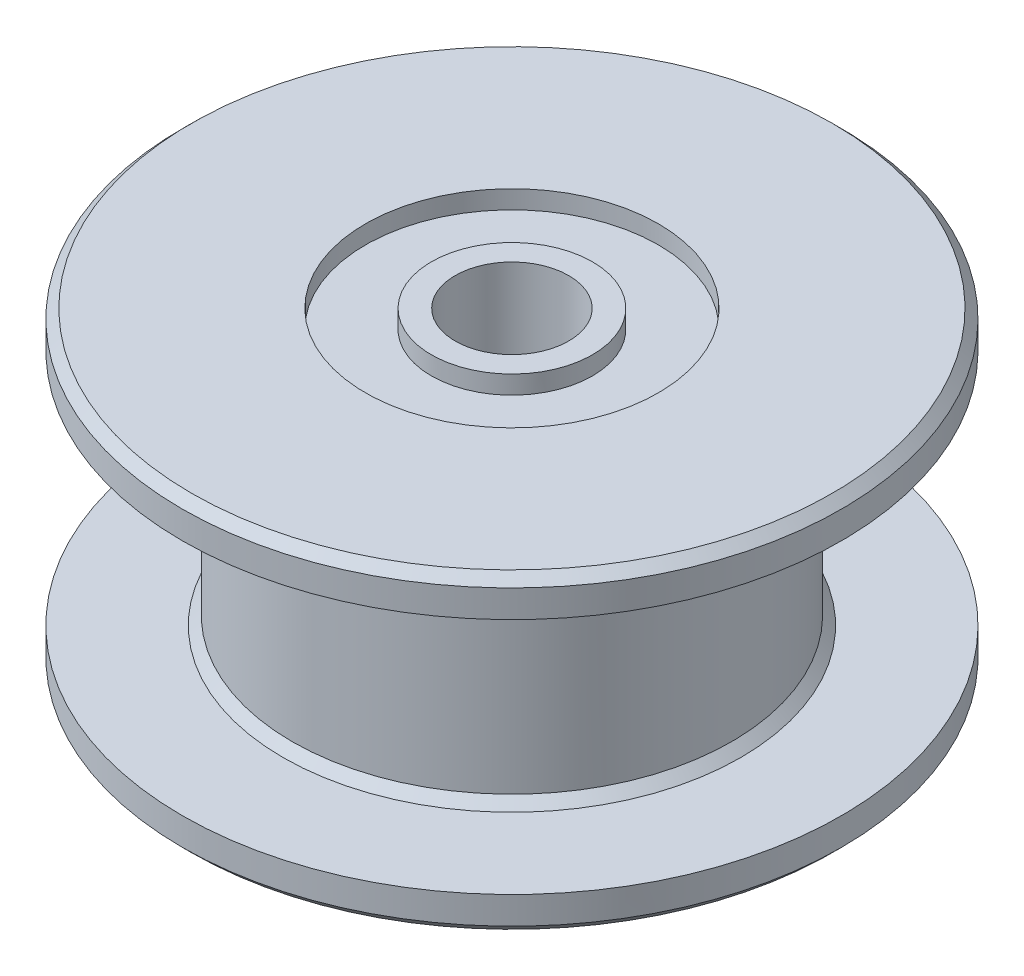
from build123d import *

# Parameters (mm, degrees)
SKETCH2_R           = 4
CUT_EXTRUDE1_DEPTH  = 0.5
SKETCH3_R           = 2.2
BOSS_EXTRUDE1_DEPTH = 0.5
SKETCH4_R           = 1.55
CUT_EXTRUDE2_DEPTH  = 16.305227865
CHAMFER1_SIZE       = 0.25


with BuildPart() as part:
    # Sketch1 → Revolve1 (revolve)
    with BuildSketch(Plane.XY, mode=Mode.PRIVATE) as revolve1_sk:
        Polygon((0, 0), (-9, 0), (-9, 1), (-6, 1), (-6, 7.5), (-9, 7.5), (-9, 8.5), (0, 8.5), align=None)
    revolve(revolve1_sk.sketch.rotate(Axis((0, 8.5, 0), (0, -1, 0)), 270), axis=Axis((0, 8.5, 0), (0, -1, 0)))

    # Sketch2 → Cut-Extrude1 (cut)
    with BuildSketch(Plane.XZ):
        with Locations(Location((0, 0, 0), (0, 0, 270))):
            Circle(SKETCH2_R)
    cut_extrude1 = extrude(amount=-CUT_EXTRUDE1_DEPTH, mode=Mode.SUBTRACT)

    # Sketch3 → Boss-Extrude1 (add)
    with BuildSketch(Plane.XZ.offset(-0.5)):
        with Locations(Location((0, 0, 0), (0, 0, 270))):
            Circle(SKETCH3_R)
    boss_extrude1 = extrude(amount=BOSS_EXTRUDE1_DEPTH)

    # Mirror1: Cut-Extrude1, Boss-Extrude1 across plane
    add(cut_extrude1.mirror(Plane.ZX.offset(4.25)), mode=Mode.SUBTRACT)
    add(boss_extrude1.mirror(Plane.ZX.offset(4.25)))

    # Sketch4 → Cut-Extrude2 (cut, through all)
    with BuildSketch(Plane.XZ):
        with Locations(Location((0, 0, 0), (0, 0, 270))):
            Circle(SKETCH4_R)
    extrude(amount=-CUT_EXTRUDE2_DEPTH, mode=Mode.SUBTRACT)

    # Chamfer1
    chamfer1_edges = [part.edges().sort_by_distance(p)[0] for p in [
        (0, 8.5, -9),
        (0, 7.5, -6),
        (0, 1, -6),
        (0, 0, -9),
    ]]
    chamfer(chamfer1_edges, length=CHAMFER1_SIZE)


solid = part.part
